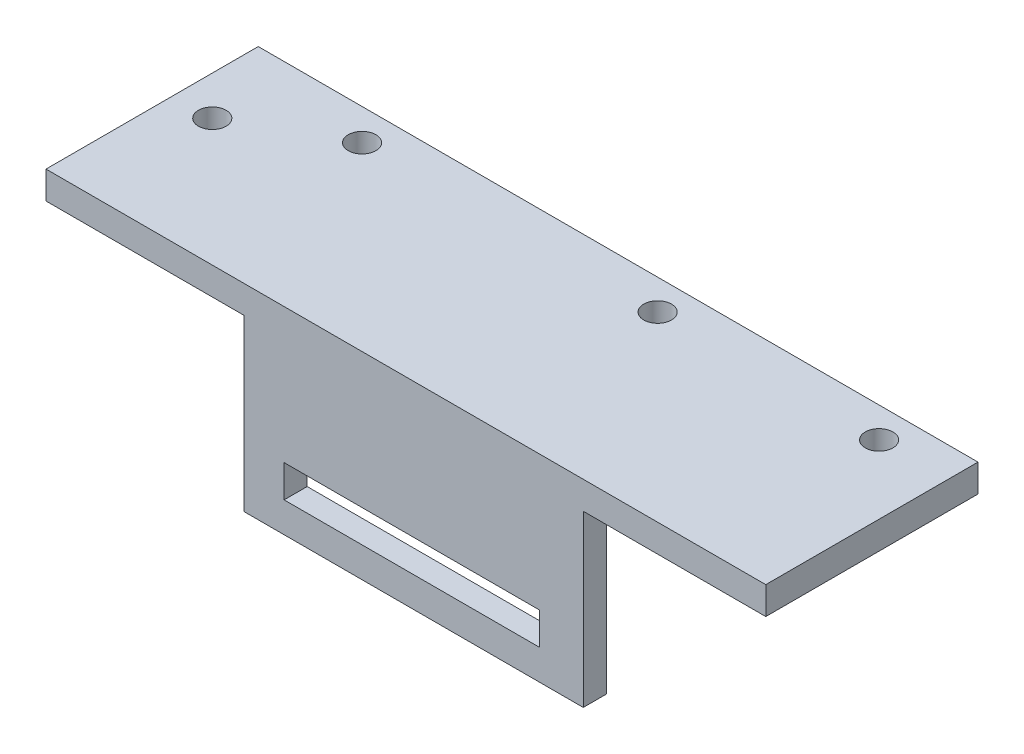
from build123d import *

# Parameters (mm, degrees)
SKETCH_1_W                = 78
SKETCH_1_H                = 15
EXTRUDE_1_DEPTH           = 3
SKETCH_3_R                = 1.5
CUT_EXTRUDE_1_DEPTH       = 3
SKETCH_4_R                = 6
EXTRUDE_2_DEPTH           = 18
SKETCH_5_R                = 4.5
CUT_EXTRUDE_2_DEPTH       = 21
F_2_0MM_2_D               = 3
F_2_0MM_2_DEPTH           = 4.5
F_2_0MM_2_TIP             = 1.5
F_2_0MM_2_ON_FACE_2_D     = 3
F_2_0MM_2_ON_FACE_2_DEPTH = 4.5
F_2_0MM_2_ON_FACE_2_TIP   = 1.5
SKETCH_10_W               = 6
SKETCH_10_H               = 10
CUT_EXTRUDE_3_DEPTH       = 7
SKETCH_13_W               = 19.835687411
SKETCH_13_H               = 21.610205193
CUT_EXTRUDE_4_DEPTH       = 20
SKETCH_14_W               = 11.523038103
SKETCH_14_H               = 10.49031299
EXTRUDE_3_DEPTH           = 3
SKETCH_18_W               = 78
SKETCH_18_H               = 8
EXTRUDE_4_DEPTH           = 3
SKETCH_19_W               = 36.767904102
SKETCH_19_H               = 2.5
EXTRUDE_5_DEPTH           = 12.5
SKETCH_23_R               = 1.65
CUT_EXTRUDE_6_DEPTH       = 12.5
SKETCH_25_W               = 4.236607592
SKETCH_25_H               = 5.36409187
EXTRUDE_7_DEPTH           = 2.5
SKETCH_26_R               = 1.6
CUT_EXTRUDE_7_DEPTH       = 2.5
SKETCH_27_W               = 21.346012392
SKETCH_27_H               = 6.594354882
EXTRUDE_8_DEPTH           = 2.5
SKETCH_28_W               = 36.767231154
SKETCH_28_H               = 5.91819544
EXTRUDE_9_DEPTH           = 2.5
SKETCH_29_W               = 27.660340415
SKETCH_29_H               = 3.5
CUT_EXTRUDE_9_DEPTH       = 2.5


with BuildPart() as part:
    # 草图1 → 凸台-拉伸1 (new body)
    with BuildSketch(Plane(origin=(0, 0, 0), x_dir=(1, 0, 0), z_dir=(0, 1, 0))):
        Rectangle(SKETCH_1_W, SKETCH_1_H)
    extrude(amount=EXTRUDE_1_DEPTH)

    # 草图3 → 切除-拉伸1 (cut)
    with BuildSketch(Plane(origin=(0, 3, 0), x_dir=(1, 0, 0), z_dir=(0, 1, 0))):
        with Locations(Location((-34.76, -1.72, 0), (0, 0, 270))):
            Circle(SKETCH_3_R)
        with Locations(Location((-24.35, 4.1, 0), (0, 0, 270))):
            Circle(SKETCH_3_R)
        with Locations(Location((31.56, 4.221692081, 0), (0, 0, 270))):
            Circle(SKETCH_3_R)
        with Locations(Location((7.56, 4.221692081, 0), (0, 0, 270))):
            Circle(SKETCH_3_R)
    extrude(amount=-CUT_EXTRUDE_1_DEPTH, mode=Mode.SUBTRACT)

    # 草图4 → 凸台-拉伸2 (add)
    with BuildSketch(Plane(origin=(0, 3, 0), x_dir=(1, 0, 0), z_dir=(0, 1, 0))):
        with Locations(Location((-3, -1.234165229, 0), (0, 0, 270))):
            Circle(SKETCH_4_R)
    extrude(amount=EXTRUDE_2_DEPTH)

    # 草图5 → 切除-拉伸2 (cut)
    with BuildSketch(Plane(origin=(0, 21, 0), x_dir=(1, 0, 0), z_dir=(0, 1, 0))):
        with Locations(Location((-3, -1.234165229, 0), (0, 0, 270))):
            Circle(SKETCH_5_R)
    extrude(amount=-CUT_EXTRUDE_2_DEPTH, mode=Mode.SUBTRACT)

    # Ø2.0mm 暗销孔2
    with Locations(Plane(origin=(-7.901331048, 17.342107422, 4.694938836), x_dir=(-0.576795601176, 0, -0.816888507977), z_dir=(-0.816888507977, 0, 0.576795601176))):
        with Locations((0, 0)):
            Hole(F_2_0MM_2_D / 2, depth=F_2_0MM_2_DEPTH)
            with Locations((0, 0, -(F_2_0MM_2_DEPTH + F_2_0MM_2_TIP / 2))):  # 90° drill point
                Cone(0, F_2_0MM_2_D / 2, F_2_0MM_2_TIP, mode=Mode.SUBTRACT)

    # Ø2.0mm 暗销孔2 on face 2
    with Locations(Plane(origin=(1.071764877, 17.164817099, 5.641061052), x_dir=(0.734483043181, 0, -0.678627039897), z_dir=(0.678627039897, 0, 0.734483043181))):
        with Locations((0, 0)):
            Hole(F_2_0MM_2_ON_FACE_2_D / 2, depth=F_2_0MM_2_ON_FACE_2_DEPTH)
            with Locations((0, 0, -(F_2_0MM_2_ON_FACE_2_DEPTH + F_2_0MM_2_ON_FACE_2_TIP / 2))):  # 90° drill point
                Cone(0, F_2_0MM_2_ON_FACE_2_D / 2, F_2_0MM_2_ON_FACE_2_TIP, mode=Mode.SUBTRACT)

    # 草图10 → 切除-拉伸3 (cut)
    with BuildSketch(Plane(origin=(0, 0, -7.5), x_dir=(-1, 0, 0), z_dir=(0, 0, -1))):
        with Locations((3, 8)):
            Rectangle(SKETCH_10_W, SKETCH_10_H)
    extrude(amount=-CUT_EXTRUDE_3_DEPTH, mode=Mode.SUBTRACT)

    # 草图13 → 切除-拉伸4 (cut)
    with BuildSketch(Plane(origin=(0, 0, -7.5), x_dir=(-1, 0, 0), z_dir=(0, 0, -1))):
        with Locations((3.314421038, 13.805102597)):
            Rectangle(SKETCH_13_W, SKETCH_13_H)
    extrude(amount=-CUT_EXTRUDE_4_DEPTH, mode=Mode.SUBTRACT)

    # 草图14 → 凸台-拉伸3 (add)
    with BuildSketch(Plane(origin=(0, 3, 0), x_dir=(1, 0, 0), z_dir=(0, 1, 0))):
        with Locations((-2.989467433, -1.263493391)):
            Rectangle(SKETCH_14_W, SKETCH_14_H)
    extrude(amount=-EXTRUDE_3_DEPTH)

    # 草图18 → 凸台-拉伸4 (add)
    with BuildSketch(Plane.XZ):
        with Locations((0, 11.5)):
            Rectangle(SKETCH_18_W, SKETCH_18_H)
    extrude(amount=-EXTRUDE_4_DEPTH)

    # 草图19 → 凸台-拉伸5 (add)
    with BuildSketch(Plane.XZ):
        with Locations((0.839237194, 14.25)):
            Rectangle(SKETCH_19_W, SKETCH_19_H)
    extrude(amount=EXTRUDE_5_DEPTH)

    # 草图23 → 切除-拉伸6 (cut)
    with BuildSketch(Plane(origin=(0, 0, 13), x_dir=(-1, 0, 0), z_dir=(0, 0, -1))):
        with Locations((-8.603189245, -6.05592298)):
            Circle(SKETCH_23_R)
        with Locations((2.596810755, -6.05592298)):
            Circle(SKETCH_23_R)
    extrude(amount=-CUT_EXTRUDE_6_DEPTH, mode=Mode.SUBTRACT)

    # 草图25 → 凸台-拉伸7 (add)
    with BuildSketch(Plane(origin=(0, 0, 13), x_dir=(-1, 0, 0), z_dir=(0, 0, -1))):
        with Locations((2.330668631, -6.426480946)):
            Rectangle(SKETCH_25_W, SKETCH_25_H)
    extrude(amount=-EXTRUDE_7_DEPTH)

    # 草图26 → 切除-拉伸7 (cut)
    with BuildSketch(Plane(origin=(0, 0, 13), x_dir=(-1, 0, 0), z_dir=(0, 0, -1))):
        with Locations((4.196810755, -6.05592298)):
            Circle(SKETCH_26_R)
    extrude(amount=-CUT_EXTRUDE_7_DEPTH, mode=Mode.SUBTRACT)

    # 草图27 → 凸台-拉伸8 (add)
    with BuildSketch(Plane(origin=(0, 0, 13), x_dir=(-1, 0, 0), z_dir=(0, 0, -1))):
        with Locations((-2.379316694, -6.691741876)):
            Rectangle(SKETCH_27_W, SKETCH_27_H)
    extrude(amount=-EXTRUDE_8_DEPTH)

    # 草图28 → 凸台-拉伸9 (add)
    with BuildSketch(Plane(origin=(0, 0, 13), x_dir=(-1, 0, 0), z_dir=(0, 0, -1))):
        with Locations((-0.839573668, -15.45909772)):
            Rectangle(SKETCH_28_W, SKETCH_28_H)
    extrude(amount=-EXTRUDE_9_DEPTH)

    # 草图29 → 切除-拉伸9 (cut)
    with BuildSketch(Plane(origin=(0, 0, 13), x_dir=(-1, 0, 0), z_dir=(0, 0, -1))):
        with Locations((-0.633763758, -13.394190827)):
            Rectangle(SKETCH_29_W, SKETCH_29_H)
    extrude(amount=-CUT_EXTRUDE_9_DEPTH, mode=Mode.SUBTRACT)


solid = part.part
